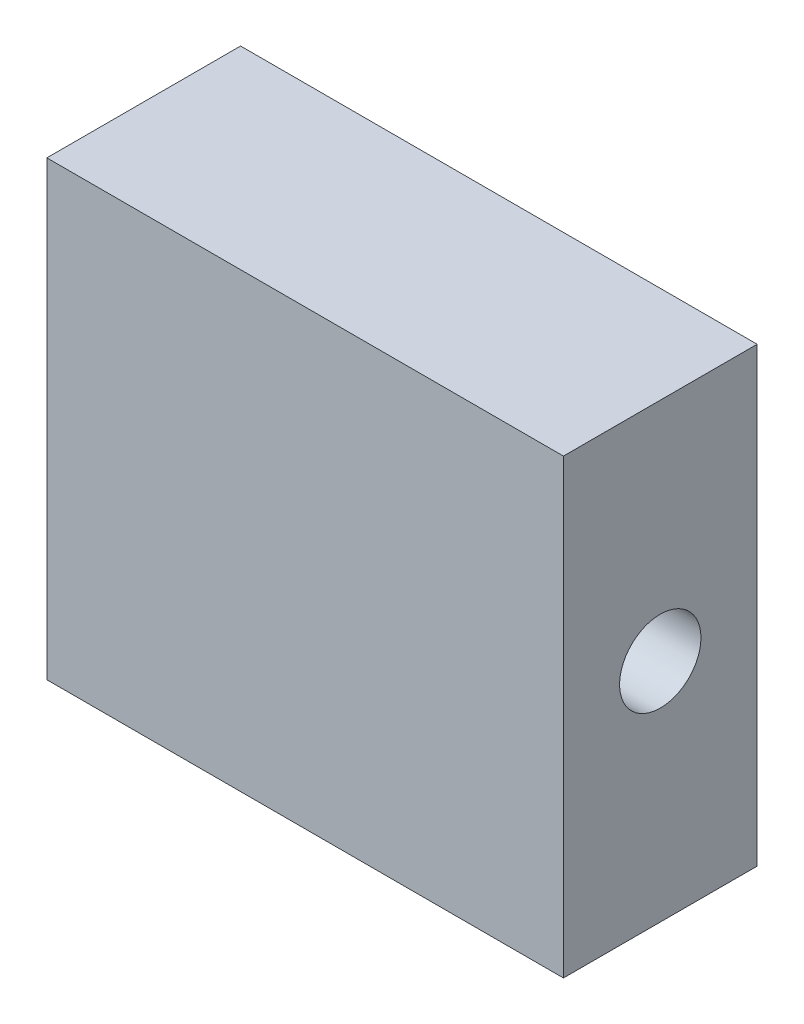
from build123d import *

# Parameters (mm, degrees)
SKETCH1_W           = 15
SKETCH1_H           = 35
SKETCH1_R           = 3.15
BOSS_EXTRUDE1_DEPTH = 40


with BuildPart() as part:
    # Sketch1 → Boss-Extrude1 (new body)
    with BuildSketch(Plane(origin=(0, 0, 0), x_dir=(0, 0, -1), z_dir=(1, 0, 0))):
        Rectangle(SKETCH1_W, SKETCH1_H)
        Circle(SKETCH1_R, mode=Mode.SUBTRACT)
    extrude(amount=BOSS_EXTRUDE1_DEPTH)


solid = part.part
